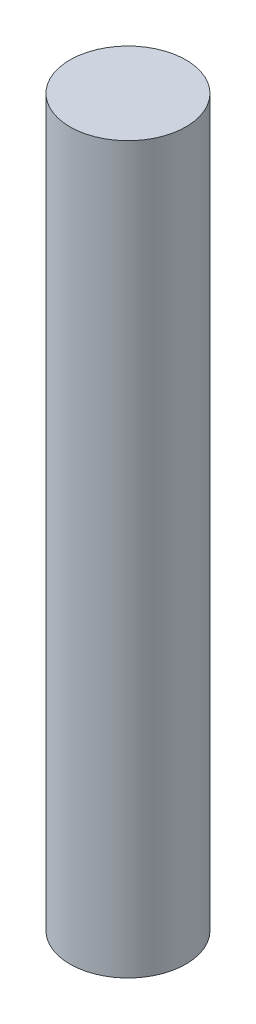
from build123d import *

# Parameters (mm, degrees)
SKETCH1_R           = 2.4
BOSS_EXTRUDE1_DEPTH = 30


with BuildPart() as part:
    # Sketch1 → Boss-Extrude1 (new body)
    with BuildSketch(Plane(origin=(0, 0, 0), x_dir=(1, 0, 0), z_dir=(0, 1, 0))):
        with Locations(Location((0, 0, 0), (0, 0, 270))):
            Circle(SKETCH1_R)
    extrude(amount=BOSS_EXTRUDE1_DEPTH)


solid = part.part
